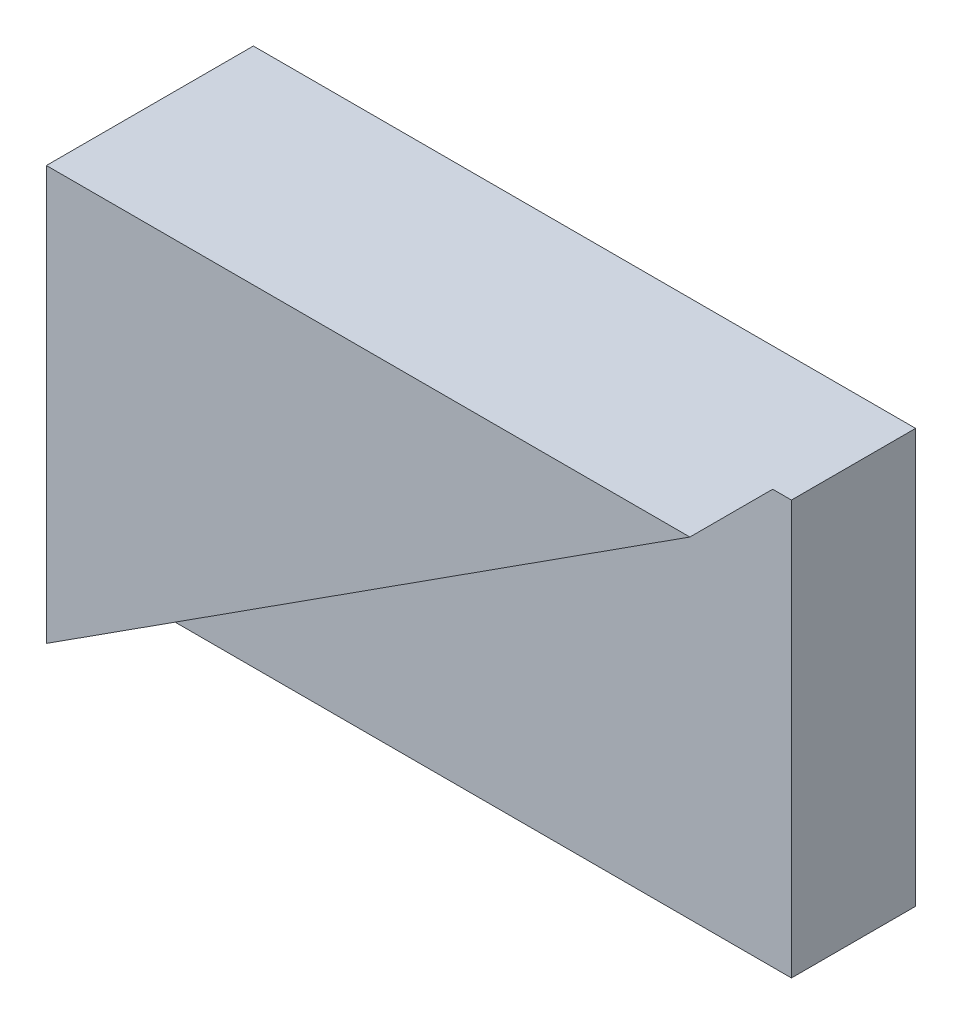
from build123d import *

# Parameters (mm, degrees)
SKETCH_1_W          = 16
SKETCH_1_H          = 10
EXTRUDE_1_DEPTH     = 5
CUT_EXTRUDE_1_DEPTH = 2


with BuildPart() as part:
    # 草图1 → 凸台-拉伸1 (new body)
    with BuildSketch(Plane.XY):
        with Locations((8, 5)):
            Rectangle(SKETCH_1_W, SKETCH_1_H)
    extrude(amount=EXTRUDE_1_DEPTH)

    # 草图2 → 切除-拉伸1 (cut)
    with BuildSketch(Plane.XY.offset(5)):
        Polygon((0, 0), (16, 0), (16, 10.291545824), align=None)
    extrude(amount=-CUT_EXTRUDE_1_DEPTH, mode=Mode.SUBTRACT)


solid = part.part
